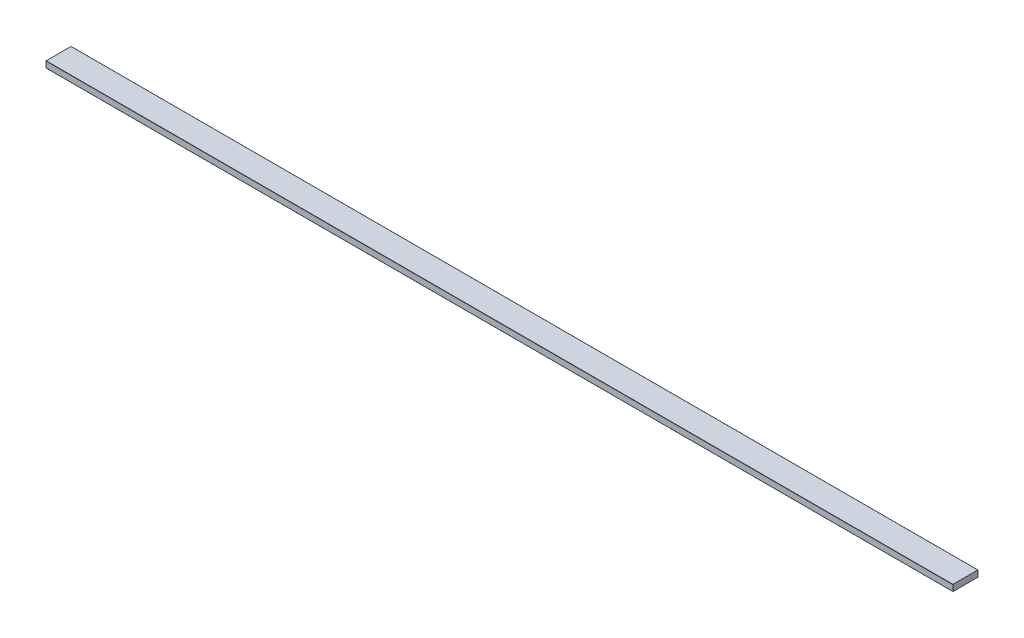
from build123d import *

# Parameters (mm, degrees)
BOSS_EXTRUDE1_DEPTH      = 3.175
BOSS_EXTRUDE1_DEPTH_BACK = 3.175
SKETCH3_W                = 914.4
SKETCH3_H                = 25.4
FILLET1_R                = 0.20955


with BuildPart() as part:
    # Sketch3 → Boss-Extrude1 (new, two sides: drawn at the far end of the back side and taken through both)
    with BuildSketch(Plane(origin=(0, 0, 0), x_dir=(1, 0, 0), z_dir=(0, 1, 0)).offset(-BOSS_EXTRUDE1_DEPTH_BACK)):
        Rectangle(SKETCH3_W, SKETCH3_H)
    extrude(amount=BOSS_EXTRUDE1_DEPTH + BOSS_EXTRUDE1_DEPTH_BACK)

    # Fillet1
    fillet1_edges = [part.edges().sort_by_distance(p)[0] for p in [
        (0, 3.175, 12.7),
        (0, -3.175, -12.7),
        (0, 3.175, -12.7),
        (0, -3.175, 12.7),
    ]]
    fillet(fillet1_edges, radius=FILLET1_R)


solid = part.part
